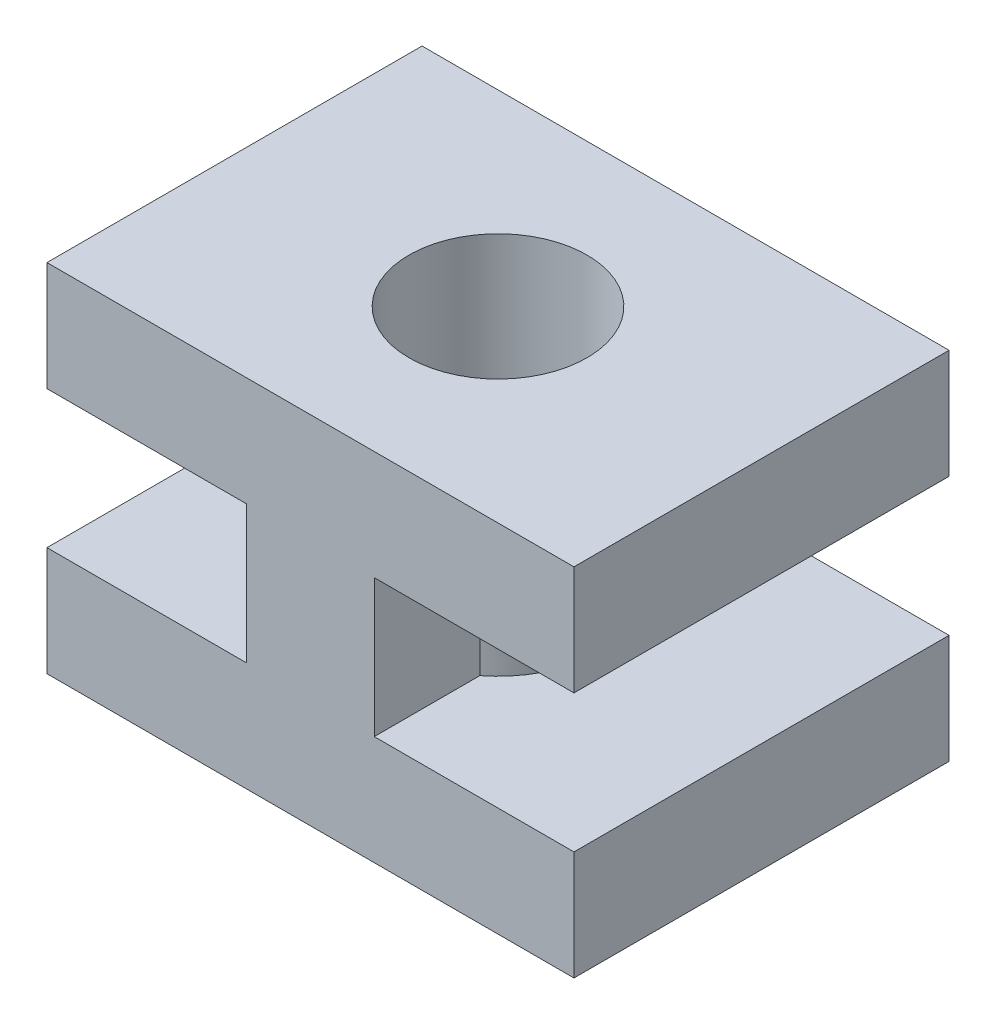
from build123d import *

# Parameters (mm, degrees)
BOSS_EXTRUDE1_DEPTH = 1.16
SKETCH2_W           = 8.88
SKETCH2_H           = 6.32
SKETCH2_R           = 1.5
BOSS_EXTRUDE2_DEPTH = 1.84


with BuildPart() as part:
    # Sketch1 → Boss-Extrude1 (new body)
    with BuildSketch(Plane(origin=(0, 0, 0), x_dir=(1, 0, 0), z_dir=(0, 1, 0))):
        with BuildLine():
            ThreePointArc((0, -1.75), (-0.568301, -1.655154), (-1.075, -1.380896))
            Line((-1.075, -1.380896), (-1.075, -3.16))
            Line((-1.075, -3.16), (0, -3.16))
            Line((0, -3.16), (0, -1.75))
        make_face()
        with BuildLine():
            ThreePointArc((1.075, -1.380896), (0.568301, -1.655154), (0, -1.75))
            Line((0, -1.75), (0, -3.16))
            Line((0, -3.16), (1.075, -3.16))
            Line((1.075, -3.16), (1.075, -1.380896))
        make_face()
        with BuildLine():
            ThreePointArc((0, 1.75), (-1.655154, 0.568301), (-1.075, -1.380896))
            ThreePointArc((-1.075, -1.380896), (-0.568301, -1.655154), (0, -1.75))
            Line((0, -1.75), (0, -1.5))
            ThreePointArc((0, -1.5), (-1.5, 0), (0, 1.5))
            Line((0, 1.5), (0, 1.75))
        make_face()
        with BuildLine():
            ThreePointArc((1.75, 0), (1.237437, 1.237437), (0, 1.75))
            Line((0, 1.75), (0, 1.5))
            ThreePointArc((0, 1.5), (1.06066, 1.06066), (1.5, 0))
            ThreePointArc((1.5, 0), (1.06066, -1.06066), (0, -1.5))
            Line((0, -1.5), (0, -1.75))
            ThreePointArc((0, -1.75), (0.568301, -1.655154), (1.075, -1.380896))
            ThreePointArc((1.075, -1.380896), (1.57222, -0.768521), (1.75, 0))
        make_face()
    boss_extrude1 = extrude(amount=BOSS_EXTRUDE1_DEPTH)

    # Sketch2 → Boss-Extrude2 (add)
    with BuildSketch(Plane(origin=(0, 1.16, 0), x_dir=(1, 0, 0), z_dir=(0, 1, 0))):
        Rectangle(SKETCH2_W, SKETCH2_H)
        with Locations(Location((0, 0, 0), (0, 0, 270))):
            Circle(SKETCH2_R, mode=Mode.SUBTRACT)
    boss_extrude2 = extrude(amount=BOSS_EXTRUDE2_DEPTH)

    # Mirror1: Boss-Extrude1, Boss-Extrude2 across plane
    add(boss_extrude1.mirror(Plane.ZX))
    add(boss_extrude2.mirror(Plane.ZX))


solid = part.part
